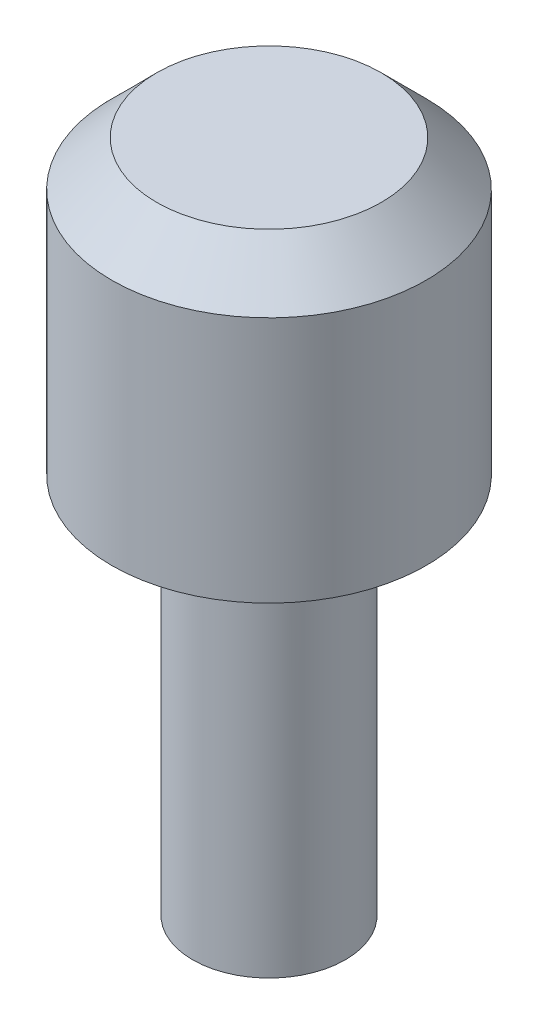
from build123d import *

# Parameters (mm, degrees)
SKETCH1_R           = 3.5
BOSS_EXTRUDE1_DEPTH = 6.5
CHAMFER1_SIZE       = 1
SKETCH2_R           = 1.7
BOSS_EXTRUDE2_DEPTH = 8.5


with BuildPart() as part:
    # Sketch1 → Boss-Extrude1 (new body)
    with BuildSketch(Plane(origin=(0, 0, 0), x_dir=(1, 0, 0), z_dir=(0, 1, 0))):
        with Locations(Location((0, 0, 0), (0, 0, 90))):
            Circle(SKETCH1_R)
    extrude(amount=BOSS_EXTRUDE1_DEPTH)

    # Chamfer1
    chamfer1_edges = [part.edges().sort_by_distance(p)[0] for p in [
        (0, 6.5, 3.5),
    ]]
    chamfer(chamfer1_edges, length=CHAMFER1_SIZE)

    # Sketch2 → Boss-Extrude2 (add)
    with BuildSketch(Plane.XZ):
        with Locations(Location((0, 0, 0), (0, 0, 90))):
            Circle(SKETCH2_R)
    extrude(amount=BOSS_EXTRUDE2_DEPTH)


solid = part.part
